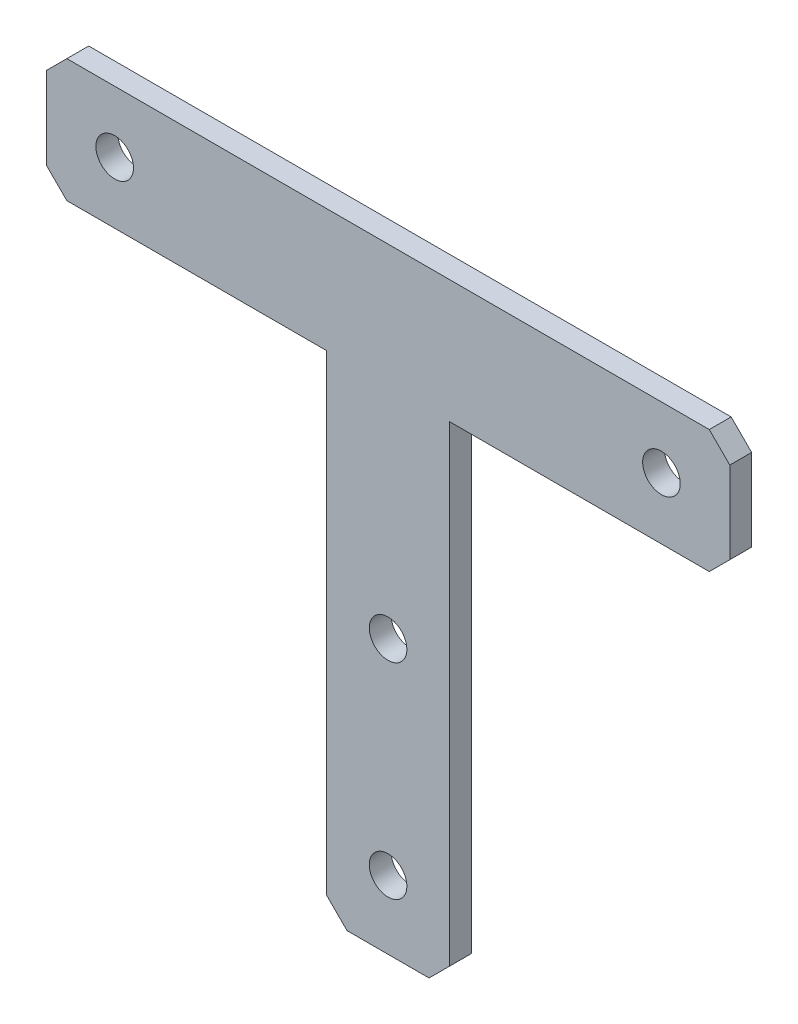
from build123d import *

# Parameters (mm, degrees)
SKETCH1_R           = 2.75
BOSS_EXTRUDE1_DEPTH = 3.2


with BuildPart() as part:
    # Sketch1 → Boss-Extrude1 (new body)
    with BuildSketch(Plane.XY):
        Polygon((-50, 75), (-47, 72), (-9, 72), (-9, 3), (-6, 0), (6, 0), (9, 3), (9, 72), (47, 72), (50, 75), (50, 87), (47, 90), (-47, 90), (-50, 87), align=None)
        with Locations((40, 81)):
            Circle(SKETCH1_R, mode=Mode.SUBTRACT)
        with Locations((0, 40)):
            Circle(SKETCH1_R, mode=Mode.SUBTRACT)
        with Locations((0, 10)):
            Circle(SKETCH1_R, mode=Mode.SUBTRACT)
        with Locations((-40, 81)):
            Circle(SKETCH1_R, mode=Mode.SUBTRACT)
    extrude(amount=-BOSS_EXTRUDE1_DEPTH)


solid = part.part
